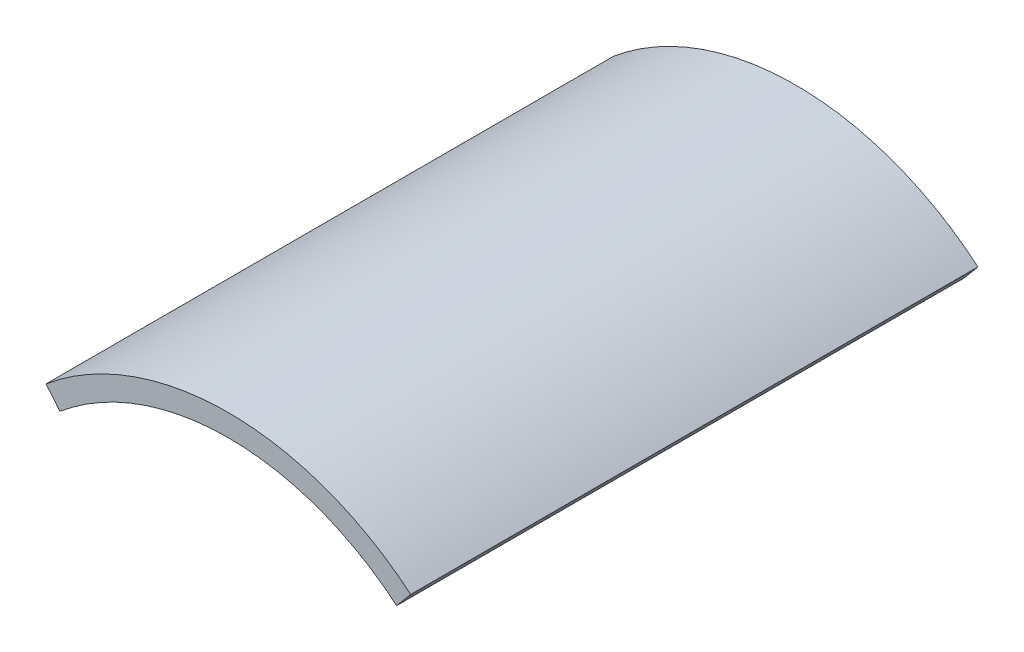
from build123d import *

# Parameters (mm, degrees)
BOSS_EXTRUDE1_DEPTH = 10
BOSS_EXTRUDE2_DEPTH = 130
CUT_EXTRUDE1_DEPTH  = 130


with BuildPart() as part:
    # Sketch1 → Boss-Extrude1 (new, symmetric)
    with BuildSketch(Plane.XY):
        with BuildLine():
            Line((38.567256581, 45.962666587), (25.711504387, 30.641777725))
            ThreePointArc((25.711504387, 30.641777725), (0, 40), (-25.711504387, 30.641777725))
            Line((-25.711504387, 30.641777725), (-38.567256581, 45.962666587))
            ThreePointArc((-38.567256581, 45.962666587), (0, 60), (38.567256581, 45.962666587))
        make_face()
    extrude(amount=BOSS_EXTRUDE1_DEPTH, both=True)

    # Sketch4 → Cut-Extrude1 (cut)
    with BuildSketch(Plane.XY.offset(10)):
        with BuildLine():
            Line((-38.567256581, 45.962666587), (-25.711504387, 30.641777725))
            ThreePointArc((-25.711504387, 30.641777725), (0, 40), (25.711504387, 30.641777725))
            Line((25.711504387, 30.641777725), (38.567256581, 45.962666587))
            ThreePointArc((38.567256581, 45.962666587), (0, 60), (-38.567256581, 45.962666587))
        make_face()
    extrude(amount=-CUT_EXTRUDE1_DEPTH, mode=Mode.SUBTRACT)


with BuildPart() as body_2:
    # Sketch3 → Boss-Extrude2 (new body)
    with BuildSketch(Plane.XY.offset(10)):
        with BuildLine():
            Line((-41.78119463, 49.792888803), (-38.567256581, 45.962666587))
            ThreePointArc((-38.567256581, 45.962666587), (0, 60), (38.567256581, 45.962666587))
            Line((38.567256581, 45.962666587), (41.78119463, 49.792888803))
            ThreePointArc((41.78119463, 49.792888803), (0, 65), (-41.78119463, 49.792888803))
        make_face()
    extrude(amount=BOSS_EXTRUDE2_DEPTH)


solid = body_2.part
